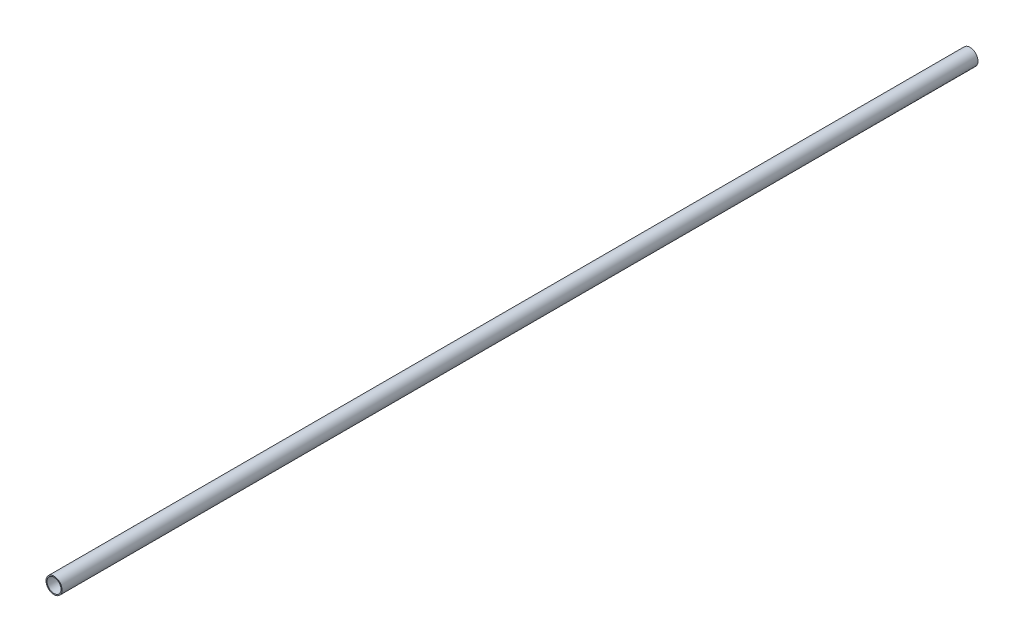
from build123d import *

# Parameters (mm, degrees)
SKETCH2_R           = 24.125
SKETCH2_R_2         = 21.075
BOSS_EXTRUDE1_DEPTH = 2750


with BuildPart() as part:
    # Sketch2 → Boss-Extrude1 (new body)
    with BuildSketch(Plane.XY):
        with Locations((2449.72011288, -5187.007415734)):
            Circle(SKETCH2_R)
        with Locations((2449.72011288, -5187.007415734)):
            Circle(SKETCH2_R_2, mode=Mode.SUBTRACT)
    extrude(amount=BOSS_EXTRUDE1_DEPTH)


solid = part.part
